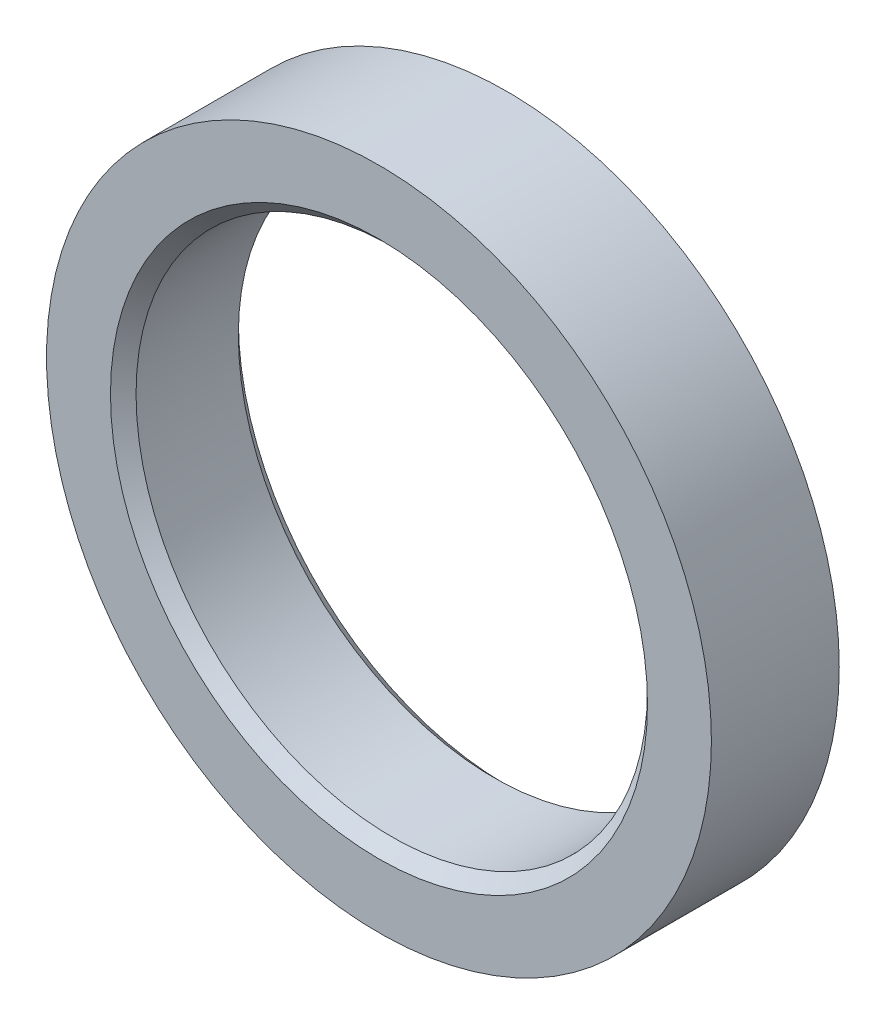
from build123d import *

# Parameters (mm, degrees)
SKETCH_1_R      = 13
SKETCH_1_R_2    = 10
EXTRUDE_1_DEPTH = 5
CHAMFER_1_SIZE  = 0.5


with BuildPart() as part:
    # 草图1 → 凸台-拉伸1 (new body)
    with BuildSketch(Plane.XY):
        Circle(SKETCH_1_R)
        Circle(SKETCH_1_R_2, mode=Mode.SUBTRACT)
    extrude(amount=EXTRUDE_1_DEPTH)

    # 倒角1
    chamfer_1_edges = [part.edges().sort_by_distance(p)[0] for p in [
        (-10, 0, 0),
        (-10, 0, 5),
    ]]
    chamfer(chamfer_1_edges, length=CHAMFER_1_SIZE)


solid = part.part
